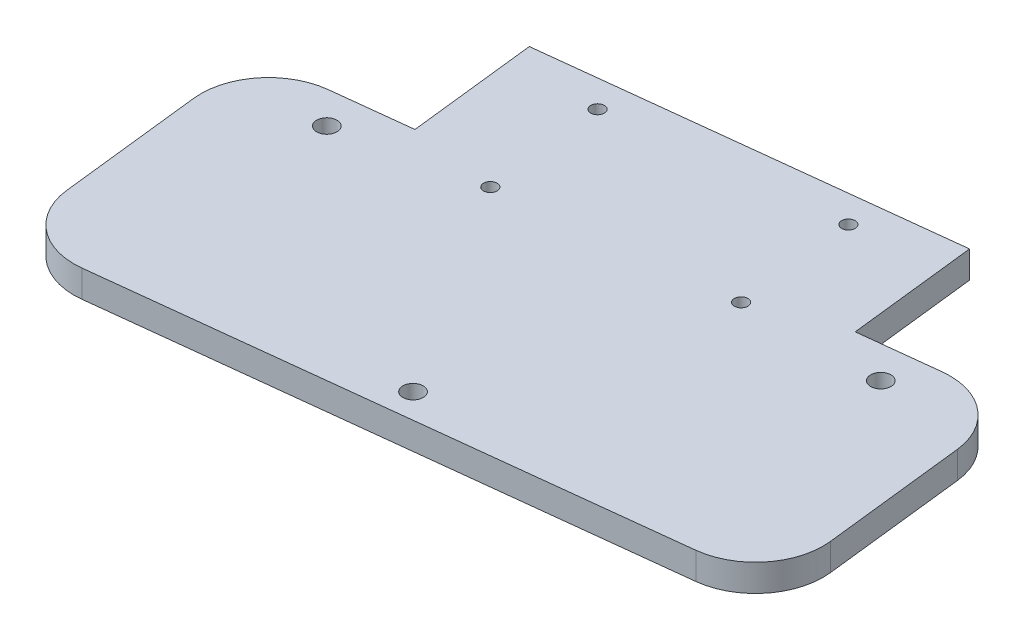
from build123d import *

# Parameters (mm, degrees)
SKETCH1_R           = 1.5
SKETCH1_R_2         = 1
BOSS_EXTRUDE1_DEPTH = 4
FILLET1_R           = 10
FILLET2_R           = 10
FILLET3_R           = 10
FILLET4_R           = 10


with BuildPart() as part:
    # Sketch1 → Boss-Extrude1 (new body)
    with BuildSketch(Plane(origin=(0, 0, 0), x_dir=(1, 0, 0), z_dir=(0, 1, 0))):
        Polygon((-43.595803766, -205.807188304), (-22.135109681, -203.371959758), (-24.298008335, -184.311199966), (34.130185477, -177.681125241), (36.293084131, -196.741885032), (57.753778216, -194.306656487), (62.409879754, -235.339014996), (-38.939702228, -246.839546813), align=None)
        with Locations(Location((-29.093140713, -209.445179895, 0), (0, 0, 270))):
            Circle(SKETCH1_R, mode=Mode.SUBTRACT)
        with Locations(Location((44.434987391, -201.101656812, 0), (0, 0, 90))):
            Circle(SKETCH1_R, mode=Mode.SUBTRACT)
        with Locations(Location((11.278933321, -237.069365642, 0), (0, 0, 270))):
            Circle(SKETCH1_R, mode=Mode.SUBTRACT)
        with Locations(Location((-9.197768444, -205.174739373, 0), (0, 0, 270))):
            Circle(SKETCH1_R_2, mode=Mode.SUBTRACT)
        with Locations(Location((-11.22676603, -187.293996073, 0), (0, 0, 270))):
            Circle(SKETCH1_R_2, mode=Mode.SUBTRACT)
        with Locations(Location((22.059616288, -183.516860623, 0), (0, 0, 270))):
            Circle(SKETCH1_R_2, mode=Mode.SUBTRACT)
        with Locations(Location((24.088613874, -201.397603923, 0), (0, 0, 270))):
            Circle(SKETCH1_R_2, mode=Mode.SUBTRACT)
    extrude(amount=BOSS_EXTRUDE1_DEPTH)

    # Fillet1
    fillet1_edges = [part.edges().sort_by_distance(p)[0] for p in [
        (-38.939702228, 2, 246.839546813),
    ]]
    fillet(fillet1_edges, radius=FILLET1_R)

    # Fillet2
    fillet2_edges = [part.edges().sort_by_distance(p)[0] for p in [
        (62.409879754, 2, 235.339014996),
    ]]
    fillet(fillet2_edges, radius=FILLET2_R)

    # Fillet3
    fillet3_edges = [part.edges().sort_by_distance(p)[0] for p in [
        (57.753778216, 2, 194.306656487),
    ]]
    fillet(fillet3_edges, radius=FILLET3_R)

    # Fillet4
    fillet4_edges = [part.edges().sort_by_distance(p)[0] for p in [
        (-43.595803766, 2, 205.807188304),
    ]]
    fillet(fillet4_edges, radius=FILLET4_R)


solid = part.part
